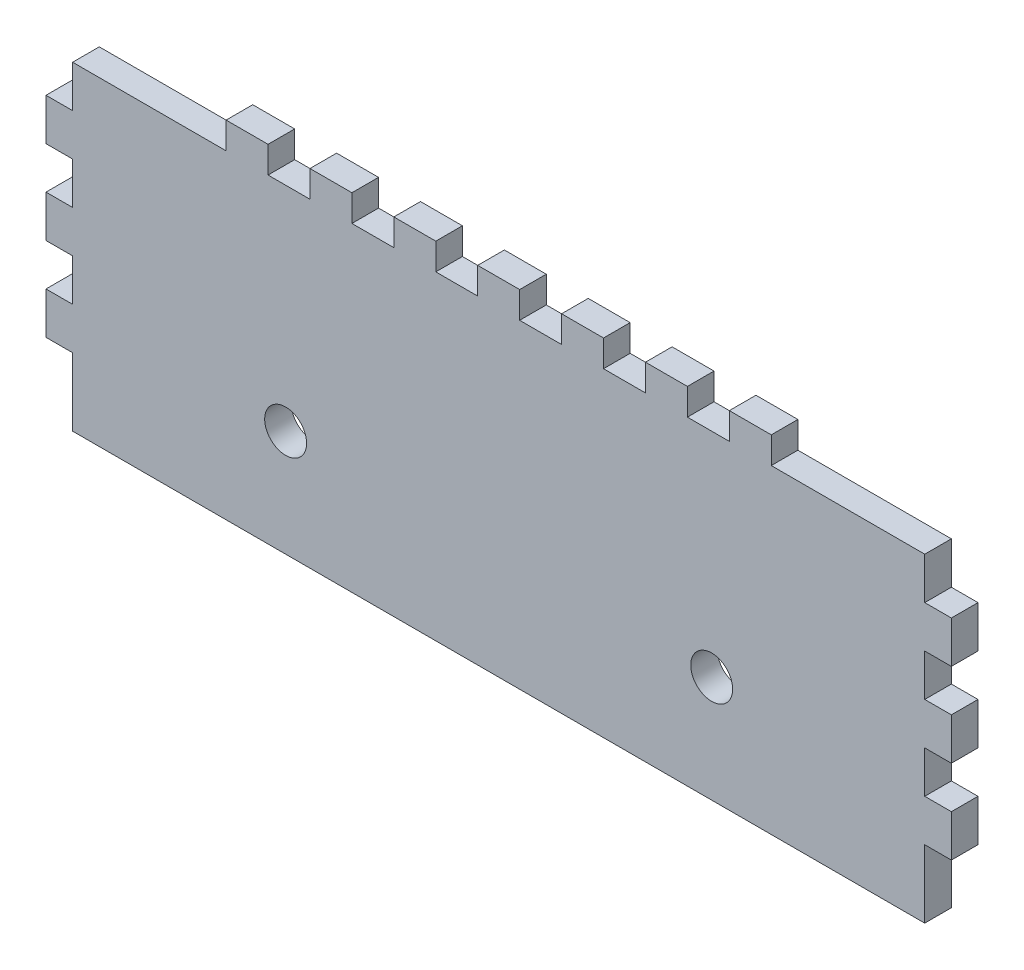
from build123d import *

# Parameters (mm, degrees)
SKETCH1_R           = 2.5
BOSS_EXTRUDE1_DEPTH = 3.175


with BuildPart() as part:
    # Sketch1 → Boss-Extrude1 (new body)
    with BuildSketch(Plane.XY):
        Polygon((-101.6, 0), (-83.3, 0), (-83.3, 3.175), (-78.3, 3.175), (-78.3, 0), (-73.3, 0), (-73.3, 3.175), (-68.3, 3.175), (-68.3, 0), (-63.3, 0), (-63.3, 3.175), (-58.3, 3.175), (-58.3, 0), (-53.3, 0), (-53.3, 3.175), (-48.3, 3.175), (-48.3, 0), (-43.3, 0), (-43.3, 3.175), (-38.3, 3.175), (-38.3, 0), (-33.3, 0), (-33.3, 3.175), (-28.3, 3.175), (-28.3, 0), (-23.3, 0), (-23.3, 3.175), (-18.3, 3.175), (-18.3, 0), (0, 0), (0, -5), (3.175, -5), (3.175, -10), (0, -10), (0, -15), (3.175, -15), (3.175, -20), (0, -20), (0, -25), (3.175, -25), (3.175, -30), (0, -30), (0, -38.1), (-101.6, -38.1), (-101.6, -30), (-104.775, -30), (-104.775, -25), (-101.6, -25), (-101.6, -20), (-104.775, -20), (-104.775, -15), (-101.6, -15), (-101.6, -10), (-104.775, -10), (-104.775, -5), (-101.6, -5), align=None)
        with Locations((-76.2, -25.4)):
            Circle(SKETCH1_R, mode=Mode.SUBTRACT)
        with Locations((-25.4, -25.4)):
            Circle(SKETCH1_R, mode=Mode.SUBTRACT)
    extrude(amount=BOSS_EXTRUDE1_DEPTH)


solid = part.part
